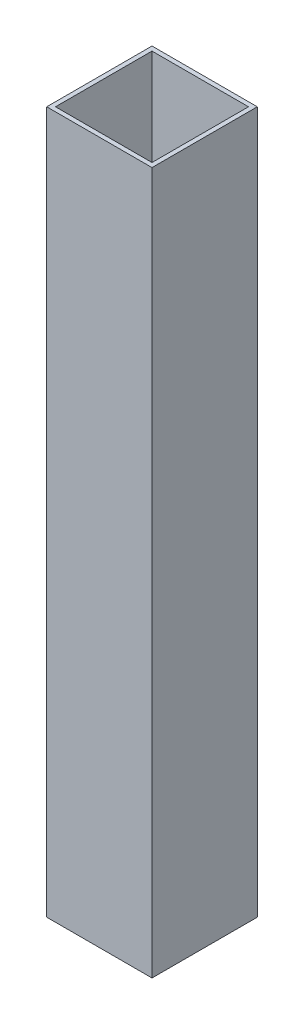
from build123d import *

# Parameters (mm, degrees)
SKETCH1_W           = 38.1
SKETCH1_H           = 38.1
SKETCH1_W_2         = 34.925
SKETCH1_H_2         = 34.925
BOSS_EXTRUDE1_DEPTH = 254


with BuildPart() as part:
    # Sketch1 → Boss-Extrude1 (new body)
    with BuildSketch(Plane(origin=(0, 0, 0), x_dir=(1, 0, 0), z_dir=(0, 1, 0))):
        Rectangle(SKETCH1_W, SKETCH1_H)
        Rectangle(SKETCH1_W_2, SKETCH1_H_2, mode=Mode.SUBTRACT)
    extrude(amount=BOSS_EXTRUDE1_DEPTH)


solid = part.part
